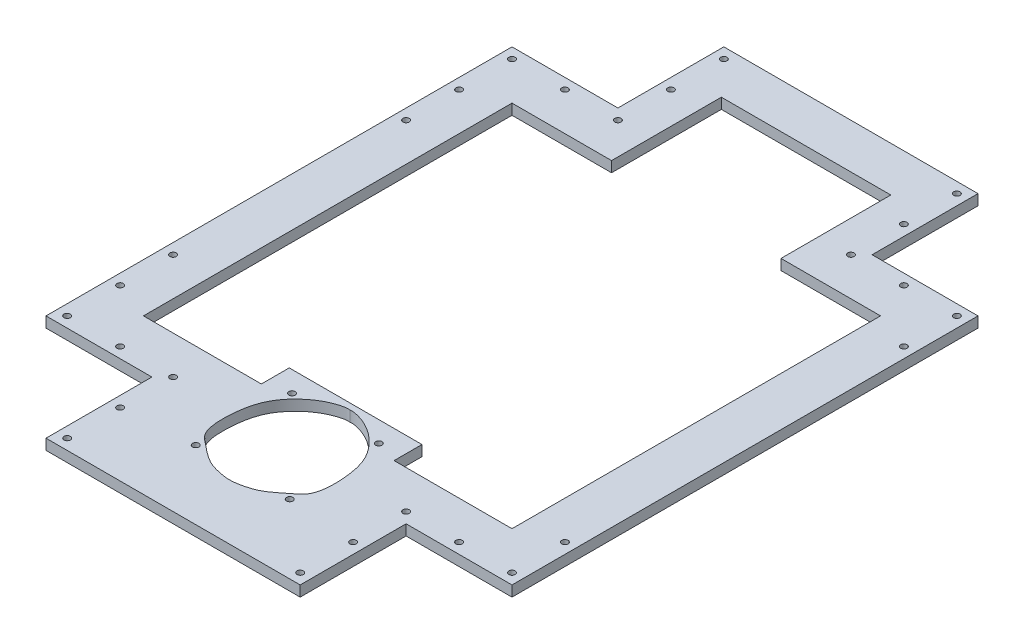
from build123d import *

# Parameters (mm, degrees)
ESQUISSE1_R             = 1.5
ESQUISSE1_R_2           = 1.499999995
ESQUISSE1_R_3           = 1.500000001
BOSS_EXTRU_1_DEPTH      = 5
ESQUISSE2_R             = 1.5
ENL_V_MAT_EXTRU_1_DEPTH = 5


with BuildPart() as part:
    # Esquisse1 → Boss.-Extru.1 (new body)
    with BuildSketch(Plane(origin=(0, 0, 0), x_dir=(1, 0, 0), z_dir=(0, 1, 0))):
        Polygon((-60, 110), (-60, 160), (60, 160), (60, 110), (110, 110), (110, -110), (60, -110), (60, -160), (-60, -160), (-60, -110), (-110, -110), (-110, 0), (-110, 110), align=None)
        with Locations(Location((-105, -105, 0), (0, 0, 270))):
            Circle(ESQUISSE1_R, mode=Mode.SUBTRACT)
        with Locations(Location((-105, -55, 0), (0, 0, 270))):
            Circle(ESQUISSE1_R, mode=Mode.SUBTRACT)
        with Locations(Location((-55, -105, 0), (0, 0, 270))):
            Circle(ESQUISSE1_R, mode=Mode.SUBTRACT)
        with Locations(Location((-55, -155, 0), (0, 0, 270))):
            Circle(ESQUISSE1_R, mode=Mode.SUBTRACT)
        with Locations(Location((-55, 155, 0), (0, 0, 90))):
            Circle(ESQUISSE1_R, mode=Mode.SUBTRACT)
        with Locations(Location((-55, 105, 0), (0, 0, 90))):
            Circle(ESQUISSE1_R, mode=Mode.SUBTRACT)
        with Locations(Location((-105, 105, 0), (0, 0, 90))):
            Circle(ESQUISSE1_R, mode=Mode.SUBTRACT)
        with Locations(Location((-105, 55, 0), (0, 0, 90))):
            Circle(ESQUISSE1_R, mode=Mode.SUBTRACT)
        with Locations(Location((55, -155, 0), (0, 0, 90))):
            Circle(ESQUISSE1_R, mode=Mode.SUBTRACT)
        with Locations(Location((55, -105, 0), (0, 0, 90))):
            Circle(ESQUISSE1_R, mode=Mode.SUBTRACT)
        with Locations(Location((105, -105, 0), (0, 0, 90))):
            Circle(ESQUISSE1_R, mode=Mode.SUBTRACT)
        with Locations(Location((105, 105, 0), (0, 0, 270))):
            Circle(ESQUISSE1_R, mode=Mode.SUBTRACT)
        with Locations(Location((55, 105, 0), (0, 0, 270))):
            Circle(ESQUISSE1_R, mode=Mode.SUBTRACT)
        with Locations(Location((55, 155, 0), (0, 0, 270))):
            Circle(ESQUISSE1_R, mode=Mode.SUBTRACT)
        with Locations(Location((-20.263921607, -83.580815365, 0), (0, 0, 270))):
            Circle(ESQUISSE1_R, mode=Mode.SUBTRACT)
        with Locations(Location((20.686866729, -83.580815365, 0), (0, 0, 270))):
            Circle(ESQUISSE1_R_2, mode=Mode.SUBTRACT)
        with Locations(Location((22.476974657, -127.410006662, 0), (0, 0, 270))):
            Circle(ESQUISSE1_R_3, mode=Mode.SUBTRACT)
        with Locations(Location((-21.804614529, -127.50597342, 0), (0, 0, 270))):
            Circle(ESQUISSE1_R, mode=Mode.SUBTRACT)
        Polygon((-40, 138.836374596), (40, 138.836374596), (40, 87), (87, 87), (87, -87), (31.326862642, -87), (31.326862642, -73.839408228), (-31.326862646, -73.839408228), (-31.326862646, -87), (-87, -87), (-87, 87), (-40, 87), align=None, mode=Mode.SUBTRACT)
        with BuildLine():
            add(Edge.make_bspline(
                [(0.293780888, -76.726336566), (-0.996088195, -76.578291907), (-4.699230167, -77.207421086), (-11.368955783, -80.020833344), (-17.338132033, -84.895696313), (-23.699116857, -93.09913388), (-26.473794847, -103.394022574), (-26.398842017, -120.164373886), (-18.920830658, -125.430457585), (-12.734895056, -130.805440699), (-5.32063418, -133.167404841), (-1.132230329, -133.810542206), (0.293780888, -133.661970747)],
                knots=[0, 0, 0, 0, 0.044371954, 0.129133426, 0.24755985, 0.307901827, 0.482602167, 0.644889464, 0.731533462, 0.853727, 0.909620458, 1, 1, 1, 1], degree=3))
            add(Edge.make_bspline(
                [(0.293780888, -76.726336566), (1.583649972, -76.578291907), (5.286791943, -77.207421086), (11.95651756, -80.020833344), (17.925693809, -84.895696313), (24.286678634, -93.09913388), (27.061356623, -103.394022574), (26.986403794, -120.164373886), (19.508392434, -125.430457585), (13.322456832, -130.805440699), (5.908195957, -133.167404841), (1.719792105, -133.810542206), (0.293780888, -133.661970747)],
                knots=[0, 0, 0, 0, 0.044371954, 0.129133426, 0.24755985, 0.307901827, 0.482602167, 0.644889464, 0.731533462, 0.853727, 0.909620458, 1, 1, 1, 1], degree=3))
        make_face(mode=Mode.SUBTRACT)
    extrude(amount=BOSS_EXTRU_1_DEPTH)

    # Esquisse2 → Enlèv. mat.-Extru.1 (cut)
    with BuildSketch(Plane(origin=(0, 5, 0), x_dir=(1, 0, 0), z_dir=(0, 1, 0))):
        with Locations(Location((-105, -80, 0), (0, 0, 270))):
            Circle(ESQUISSE2_R)
        with Locations(Location((-80, -105, 0), (0, 0, 270))):
            Circle(ESQUISSE2_R)
        with Locations(Location((-55, -130, 0), (0, 0, 270))):
            Circle(ESQUISSE2_R)
        with Locations(Location((55, -130, 0), (0, 0, 270))):
            Circle(ESQUISSE2_R)
        with Locations(Location((80, -105, 0), (0, 0, 270))):
            Circle(ESQUISSE2_R)
        with Locations(Location((105, -80, 0), (0, 0, 270))):
            Circle(ESQUISSE2_R)
        with Locations(Location((105, 80, 0), (0, 0, 270))):
            Circle(ESQUISSE2_R)
        with Locations(Location((80, 105, 0), (0, 0, 270))):
            Circle(ESQUISSE2_R)
        with Locations(Location((55, 130, 0), (0, 0, 270))):
            Circle(ESQUISSE2_R)
        with Locations(Location((-55, 130, 0), (0, 0, 270))):
            Circle(ESQUISSE2_R)
        with Locations(Location((-80, 105, 0), (0, 0, 270))):
            Circle(ESQUISSE2_R)
        with Locations(Location((-105, 80, 0), (0, 0, 270))):
            Circle(ESQUISSE2_R)
    extrude(amount=-ENL_V_MAT_EXTRU_1_DEPTH, mode=Mode.SUBTRACT)


solid = part.part
